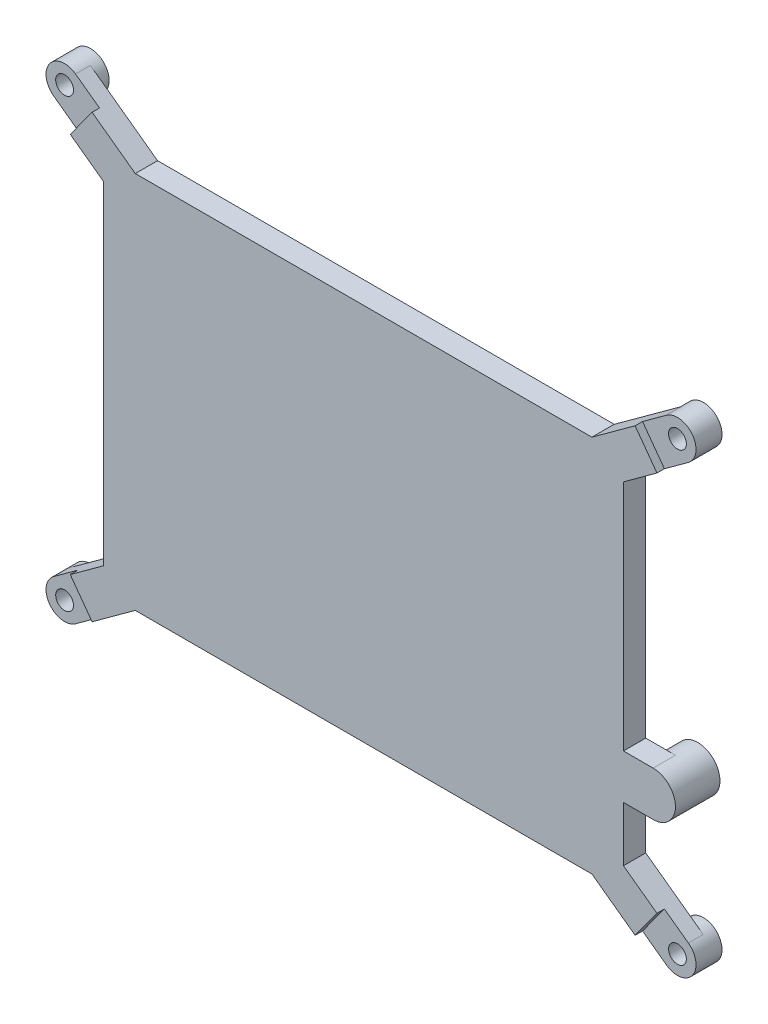
from build123d import *

# Parameters (mm, degrees)
BOSS_EXTRUDE1_DEPTH                            = 3
BOSS_EXTRUDE4_START                            = 1.5
SKETCH5_R                                      = 2.5
BOSS_EXTRUDE4_DEPTH                            = 1.5
SKETCH3_R                                      = 1.2
CUT_EXTRUDE1_DEPTH                             = 75.488325428
CUT_EXTRUDE2_START                             = -1
CUT_EXTRUDE2_DEPTH                             = 1
BOSS_EXTRUDE6_START                            = 3
SKETCH8_R                                      = 3
BOSS_EXTRUDE6_DEPTH                            = 3
CSK_FOR_M2_FLAT_HEAD_MACHINE_SCREW1_AT_2_COUNT = 2
CSK_FOR_M2_FLAT_HEAD_MACHINE_SCREW1_AT_2_PITCH = 69.354163538


with BuildPart() as part:
    # Sketch1 → Boss-Extrude1 (new body)
    with BuildSketch(Plane.XY):
        with BuildLine():
            Line((-39.803551907, 59.621098837), (-30.752483537, 53.031526348))
            Line((-30.752483537, 53.031526348), (30.752483537, 53.031526348))
            Line((30.752483537, 53.031526348), (39.803551907, 59.621098837))
            ThreePointArc((39.803551907, 59.621098837), (43.296098837, 59.071448093), (42.746448093, 55.578901163))
            Line((42.746448093, 55.578901163), (35, 49.939149129))
            Line((35, 49.939149129), (35, 18.55))
            Line((35, 18.55), (39, 18.55))
            ThreePointArc((39, 18.55), (42, 15.55), (39, 12.55))
            Line((39, 12.55), (35, 12.55))
            Line((35, 12.55), (35, 5.160850871))
            Line((35, 5.160850871), (42.746448093, -0.478901163))
            ThreePointArc((42.746448093, -0.478901163), (43.296098837, -3.971448093), (39.803551907, -4.521098837))
            Line((39.803551907, -4.521098837), (30.752483537, 2.068473652))
            Line((30.752483537, 2.068473652), (-30.752483537, 2.068473652))
            Line((-30.752483537, 2.068473652), (-39.803551907, -4.521098837))
            ThreePointArc((-39.803551907, -4.521098837), (-43.296098837, -3.971448093), (-42.746448093, -0.478901163))
            Line((-42.746448093, -0.478901163), (-35, 5.160850871))
            Line((-35, 5.160850871), (-35, 49.939149129))
            Line((-35, 49.939149129), (-42.746448093, 55.578901163))
            ThreePointArc((-42.746448093, 55.578901163), (-43.296098837, 59.071448093), (-39.803551907, 59.621098837))
        make_face()
    extrude(amount=BOSS_EXTRUDE1_DEPTH)

    # Sketch5 → Boss-Extrude4 (add)
    with BuildSketch(Plane(origin=(0, 0, 0), x_dir=(-1, 0, 0), z_dir=(0, 0, -1)).offset(BOSS_EXTRUDE4_START)):
        with Locations((-41.275, 57.6)):
            Circle(SKETCH5_R)
        with Locations((41.275, 57.6)):
            Circle(SKETCH5_R)
        with Locations((-41.275, -2.5)):
            Circle(SKETCH5_R)
        with Locations((41.275, -2.5)):
            Circle(SKETCH5_R)
    extrude(amount=-BOSS_EXTRUDE4_DEPTH)

    # Sketch3 → Cut-Extrude1 (cut, through all)
    with BuildSketch(Plane.XY.offset(3)):
        with Locations((-41.275, 57.6)):
            Circle(SKETCH3_R)
        with Locations((41.275, 57.6)):
            Circle(SKETCH3_R)
        with Locations((-41.275, -2.5)):
            Circle(SKETCH3_R)
        with Locations((41.275, -2.5)):
            Circle(SKETCH3_R)
    extrude(amount=-CUT_EXTRUDE1_DEPTH, mode=Mode.SUBTRACT)

    # Sketch7 → Cut-Extrude2 (cut)
    with BuildSketch(Plane.XY.offset(3).offset(CUT_EXTRUDE2_START)):
        with BuildLine():
            Line((-36.569793768, 57.266781888), (-39.512689954, 53.224584214))
            Line((-39.512689954, 53.224584214), (-42.746448093, 55.578901163))
            ThreePointArc((-42.746448093, 55.578901163), (-43.296098837, 59.071448093), (-39.803551907, 59.621098837))
            Line((-39.803551907, 59.621098837), (-36.569793768, 57.266781888))
        make_face()
        with BuildLine():
            Line((-42.746448093, -0.478901163), (-39.512689954, 1.875415786))
            Line((-39.512689954, 1.875415786), (-36.569793768, -2.166781888))
            Line((-36.569793768, -2.166781888), (-39.803551907, -4.521098837))
            ThreePointArc((-39.803551907, -4.521098837), (-43.296098837, -3.971448093), (-42.746448093, -0.478901163))
        make_face()
        with BuildLine():
            Line((39.803551907, -4.521098837), (36.569793768, -2.166781888))
            Line((36.569793768, -2.166781888), (39.512689954, 1.875415786))
            Line((39.512689954, 1.875415786), (42.746448093, -0.478901163))
            ThreePointArc((42.746448093, -0.478901163), (43.296098837, -3.971448093), (39.803551907, -4.521098837))
        make_face()
        with BuildLine():
            Line((39.803551907, 59.621098837), (36.569793768, 57.266781888))
            Line((36.569793768, 57.266781888), (39.512689954, 53.224584214))
            Line((39.512689954, 53.224584214), (42.746448093, 55.578901163))
            ThreePointArc((42.746448093, 55.578901163), (43.296098837, 59.071448093), (39.803551907, 59.621098837))
        make_face()
    extrude(amount=CUT_EXTRUDE2_DEPTH, mode=Mode.SUBTRACT)

    # Sketch8 → Boss-Extrude6 (add)
    with BuildSketch(Plane(origin=(0, 0, 0), x_dir=(-1, 0, 0), z_dir=(0, 0, -1)).offset(BOSS_EXTRUDE6_START)):
        with Locations((-39, 15.55)):
            Circle(SKETCH8_R)
        with Locations(Location((30, 8.55, 0), (0, 0, 180))):
            Circle(SKETCH8_R)
    extrude(amount=-BOSS_EXTRUDE6_DEPTH)

    # Sketch11 → CSK for M2 Flat Head Machine Screw1 (revolve, cut)
    with BuildSketch(Plane(origin=(39, 15.55, -3), x_dir=(0, 1, 0), z_dir=(1, 0, 0))):
        Polygon((0, 0), (0, 4.901290929), (1.5, 4), (1.5, 0.503826859), (1.635, 0), align=None)
    csk_for_m2_flat_head_machine_screw1 = revolve(axis=Axis((39, 15.55, -9.35), (0, 0, 1)), mode=Mode.SUBTRACT)

    # CSK for M2 Flat Head Machine Screw1 at 2: CSK for M2 Flat Head Machine Screw1 ×2
    with Locations(*[Vector(-0.9948934062566149, -0.10093121512748267, 0) * (i * CSK_FOR_M2_FLAT_HEAD_MACHINE_SCREW1_AT_2_PITCH) for i in range(1, CSK_FOR_M2_FLAT_HEAD_MACHINE_SCREW1_AT_2_COUNT)]):
        add(csk_for_m2_flat_head_machine_screw1, mode=Mode.SUBTRACT)


solid = part.part
